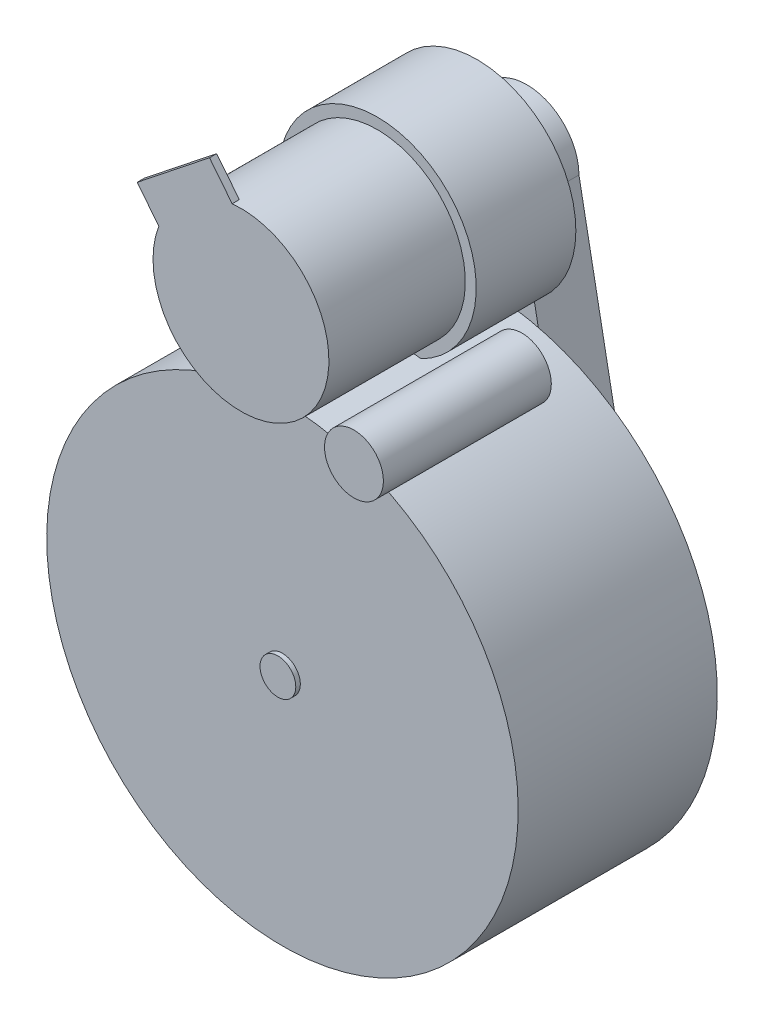
from build123d import *

# Parameters (mm, degrees)
SKETCH1_R            = 36.83
BOSS_EXTRUDE1_DEPTH  = 31.115
SKETCH2_R            = 24
BOSS_EXTRUDE2_DEPTH  = 4.318
SKETCH5_R            = 2.794
BOSS_EXTRUDE5_DEPTH  = 0.7112
SKETCH14_R           = 15.6337
BOSS_EXTRUDE11_DEPTH = 4.8514
SKETCH15_R           = 12.8016
BOSS_EXTRUDE12_DEPTH = 5.2832
SKETCH16_R           = 2.7686
BOSS_EXTRUDE13_DEPTH = 0.7112
SKETCH17_R           = 8.1534
BOSS_EXTRUDE14_DEPTH = 7.7724
SKETCH18_R           = 15.4432
BOSS_EXTRUDE15_DEPTH = 15.5702
SKETCH19_R           = 13.7414
BOSS_EXTRUDE16_DEPTH = 21.3106
BOSS_EXTRUDE17_DEPTH = 9.144
SKETCH24_R           = 2.4892
BOSS_EXTRUDE18_DEPTH = 1.9812
SKETCH25_R           = 3.2258
BOSS_EXTRUDE19_DEPTH = 3.048
SKETCH27_R           = 4.59774385
BOSS_EXTRUDE20_DEPTH = 26.2382
BOSS_EXTRUDE21_DEPTH = 1.1176


with BuildPart() as part:
    # Sketch1 → Boss-Extrude1 (new body)
    with BuildSketch(Plane.XY):
        with Locations(Location((0, 0, 0), (0, 0, 180))):
            Circle(SKETCH1_R)
    extrude(amount=BOSS_EXTRUDE1_DEPTH)

    # Sketch2 → Boss-Extrude2 (add)
    with BuildSketch(Plane(origin=(0, 0, 0), x_dir=(-1, 0, 0), z_dir=(0, 0, -1))):
        with Locations(Location((0, 0, 0), (0, 0, 180))):
            Circle(SKETCH2_R)
    extrude(amount=BOSS_EXTRUDE2_DEPTH)

    # Sketch5 → Boss-Extrude5 (add)
    with BuildSketch(Plane.XY.offset(31.115)):
        Circle(SKETCH5_R)
    extrude(amount=BOSS_EXTRUDE5_DEPTH)

    # Sketch14 → Boss-Extrude11 (add)
    with BuildSketch(Plane(origin=(0, 0, -4.318), x_dir=(-1, 0, 0), z_dir=(0, 0, -1))):
        Circle(SKETCH14_R)
    extrude(amount=BOSS_EXTRUDE11_DEPTH)

    # Sketch15 → Boss-Extrude12 (add)
    with BuildSketch(Plane(origin=(0, 0, -9.1694), x_dir=(-1, 0, 0), z_dir=(0, 0, -1))):
        Circle(SKETCH15_R)
    extrude(amount=BOSS_EXTRUDE12_DEPTH)

    # Sketch16 → Boss-Extrude13 (add)
    with BuildSketch(Plane(origin=(0, 0, -14.4526), x_dir=(-1, 0, 0), z_dir=(0, 0, -1))):
        Circle(SKETCH16_R)
    extrude(amount=BOSS_EXTRUDE13_DEPTH)



with BuildPart() as body_2:
    # Sketch17 → Boss-Extrude14 (new body)
    with BuildSketch(Plane(origin=(0, 0, -9.1694), x_dir=(-1, 0, 0), z_dir=(0, 0, -1))):
        with Locations((2.110216379, 50.3809)):
            Circle(SKETCH17_R)
    extrude(amount=-BOSS_EXTRUDE14_DEPTH)

    # Sketch18 → Boss-Extrude15 (add)
    with BuildSketch(Plane.XY.offset(-1.397)):
        with Locations((-2.110216379, 50.3809)):
            Circle(SKETCH18_R)
    extrude(amount=BOSS_EXTRUDE15_DEPTH)

    # Sketch19 → Boss-Extrude16 (add)
    with BuildSketch(Plane.XY.offset(14.1732)):
        with Locations((-2.110216379, 50.3809)):
            Circle(SKETCH19_R)
    extrude(amount=BOSS_EXTRUDE16_DEPTH)


with BuildPart() as part_1:
    add(part.part)

    add(body_2.part)  # Boss-Extrude17 merges body 2
    # Sketch23 → Boss-Extrude17 (add)
    with BuildSketch(Plane(origin=(0, 0, -9.1694), x_dir=(-1, 0, 0), z_dir=(0, 0, -1))):
        Polygon((15.6337, 0), (10.263616379, 50.3809), (-6.043183621, 50.3809), (-15.6337, 0), align=None)
    extrude(amount=-BOSS_EXTRUDE17_DEPTH)

    # Sketch24 → Boss-Extrude18 (add)
    with BuildSketch(Plane(origin=(0, 0, -9.1694), x_dir=(-1, 0, 0), z_dir=(0, 0, -1))):
        with Locations((2.110216379, 50.3809)):
            Circle(SKETCH24_R)
    extrude(amount=BOSS_EXTRUDE18_DEPTH)

    # Sketch25 → Boss-Extrude19 (add)
    with BuildSketch(Plane(origin=(0, 0, -9.1694), x_dir=(-1, 0, 0), z_dir=(0, 0, -1))):
        with Locations(Location((1.632950373, 38.986290822, 0), (0, 0, 180))):
            Circle(SKETCH25_R)
    extrude(amount=BOSS_EXTRUDE19_DEPTH)

    # Sketch27 → Boss-Extrude20 (add)
    with BuildSketch(Plane.XY.offset(35.4838)):
        with Locations((15.541092999, 38.356894356)):
            Circle(SKETCH27_R)
    extrude(amount=-BOSS_EXTRUDE20_DEPTH)

    # Sketch29 → Boss-Extrude21 (add)
    with BuildSketch(Plane.XY.offset(35.4838)):
        Polygon((-3.486888815, 64.053165612), (-7.024727103, 68.509088458), (-18.323674319, 59.53814137), (-14.946759387, 55.284902198), align=None)
    extrude(amount=-BOSS_EXTRUDE21_DEPTH)


solid = part_1.part
